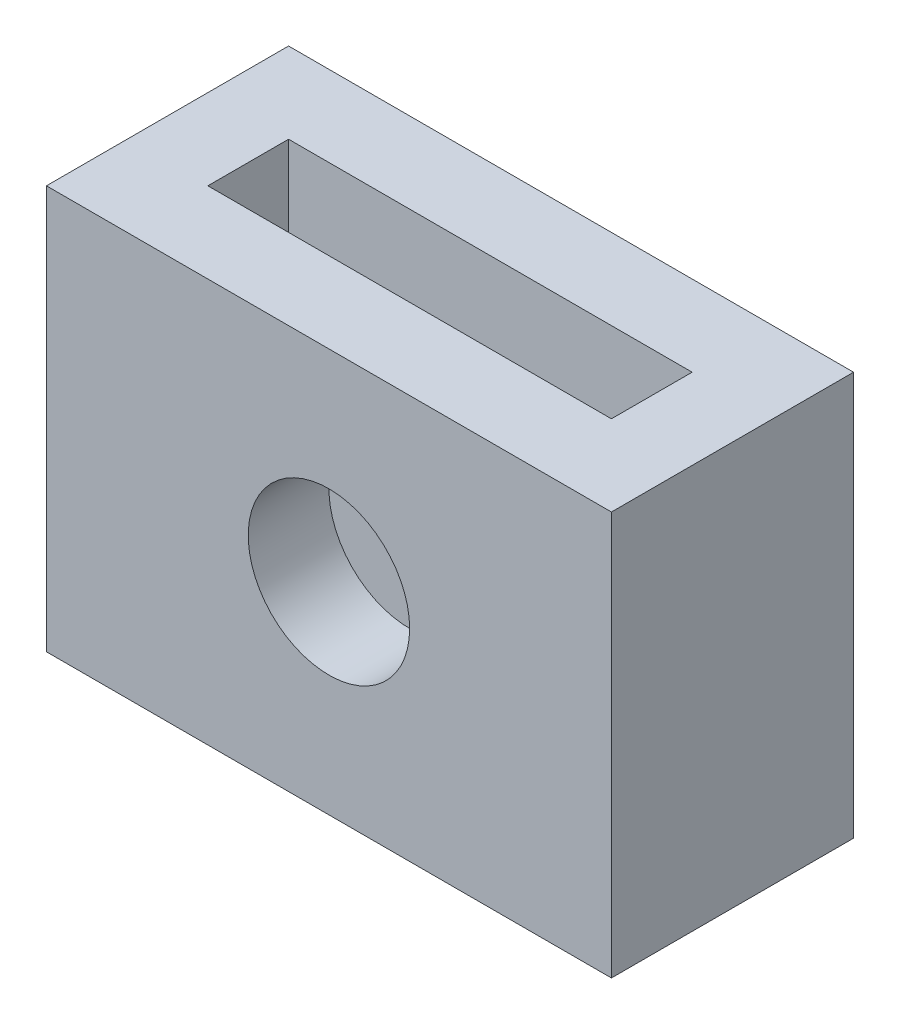
from build123d import *

# Parameters (mm, degrees)
CROQUIS1_W              = 70
CROQUIS1_H              = 50
SALIENTE_EXTRUIR1_DEPTH = 30
CROQUIS3_W              = 50
CROQUIS3_H              = 10
CORTAR_EXTRUIR1_DEPTH   = 67
CROQUIS4_R              = 10
CORTAR_EXTRUIR2_DEPTH   = 10


with BuildPart() as part:
    # Croquis1 → Saliente-Extruir1 (new body)
    with BuildSketch(Plane.XY):
        with Locations((35, 25)):
            Rectangle(CROQUIS1_W, CROQUIS1_H)
    extrude(amount=SALIENTE_EXTRUIR1_DEPTH)

    # Croquis3 → Cortar-Extruir1 (cut)
    with BuildSketch(Plane(origin=(0, 0, 0), x_dir=(1, 0, 0), z_dir=(0, 1, 0))):
        with Locations((35, -15)):
            Rectangle(CROQUIS3_W, CROQUIS3_H)
    extrude(amount=CORTAR_EXTRUIR1_DEPTH, mode=Mode.SUBTRACT)

    # Croquis4 → Cortar-Extruir2 (cut)
    with BuildSketch(Plane.XY.offset(30)):
        with Locations((35, 25)):
            Circle(CROQUIS4_R)
    extrude(amount=-CORTAR_EXTRUIR2_DEPTH, mode=Mode.SUBTRACT)


solid = part.part
